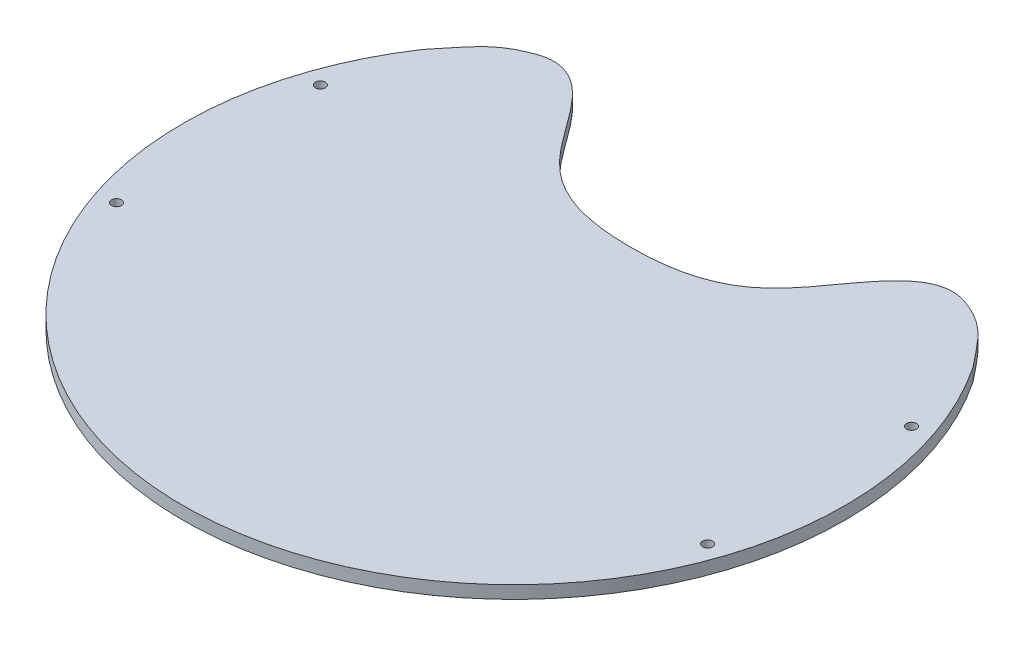
from build123d import *

# Parameters (mm, degrees)
SKETCH1_R               = 164.975
BOSS_EXTRUDE1_DEPTH     = 6.35
F_10_CLEARANCE_HOLE1_D  = 4.9784
CUT_EXTRUDE1_DEPTH      = 234.396280497
CUT_EXTRUDE1_DEPTH_BACK = 234.396280497


with BuildPart() as part:
    # Sketch1 → Boss-Extrude1 (new body)
    with BuildSketch(Plane(origin=(0, 0, 0), x_dir=(1, 0, 0), z_dir=(0, 1, 0))):
        with Locations(Location((0, 0, 0), (0, 0, 270))):
            Circle(SKETCH1_R)
    extrude(amount=BOSS_EXTRUDE1_DEPTH)

    # #10 Clearance Hole1 (through all)
    with Locations(Plane(origin=(0, 6.35, 0), x_dir=(-1, 0, 0), z_dir=(0, 1, 0))):
        with Locations((147.32, 50.8), (147.32, -50.8), (-147.32, -50.8), (-147.32, 50.8)):
            Hole(F_10_CLEARANCE_HOLE1_D / 2)

    # Sketch5 → Cut-Extrude1 (cut, two sides: drawn at the far end of the back side and taken through both)
    with BuildSketch(Plane(origin=(0, 6.35, 0), x_dir=(1, 0, 0), z_dir=(0, 1, 0)).offset(-CUT_EXTRUDE1_DEPTH_BACK)):
        with BuildLine():
            ThreePointArc((137.173488465, 91.652521446), (0, 164.975), (-137.173488464, 91.652521447))
            add(Edge.make_bspline(
                [(-137.173488464, 91.652521447), (-125.705159191, 105.996558727), (-120.870534515, 112.272122591), (-90.353097544, 124.765284351), (-63.363213117, 88.003441051), (-42.154841731, 58.106834512), (1e-09, 58.106834512)],
                knots=[0, 0, 0, 0, 0.216330934, 0.275013743, 0.586828091, 1, 1, 1, 1], degree=3))
            add(Edge.make_bspline(
                [(137.173488466, 91.652521447), (125.705159193, 105.996558727), (120.870534517, 112.272122591), (90.353097545, 124.765284351), (63.363213118, 88.003441051), (42.154841732, 58.106834512), (1e-09, 58.106834512)],
                knots=[0, 0, 0, 0, 0.216330934, 0.275013743, 0.586828091, 1, 1, 1, 1], degree=3))
        make_face()
    extrude(amount=CUT_EXTRUDE1_DEPTH + CUT_EXTRUDE1_DEPTH_BACK, mode=Mode.SUBTRACT)


solid = part.part
